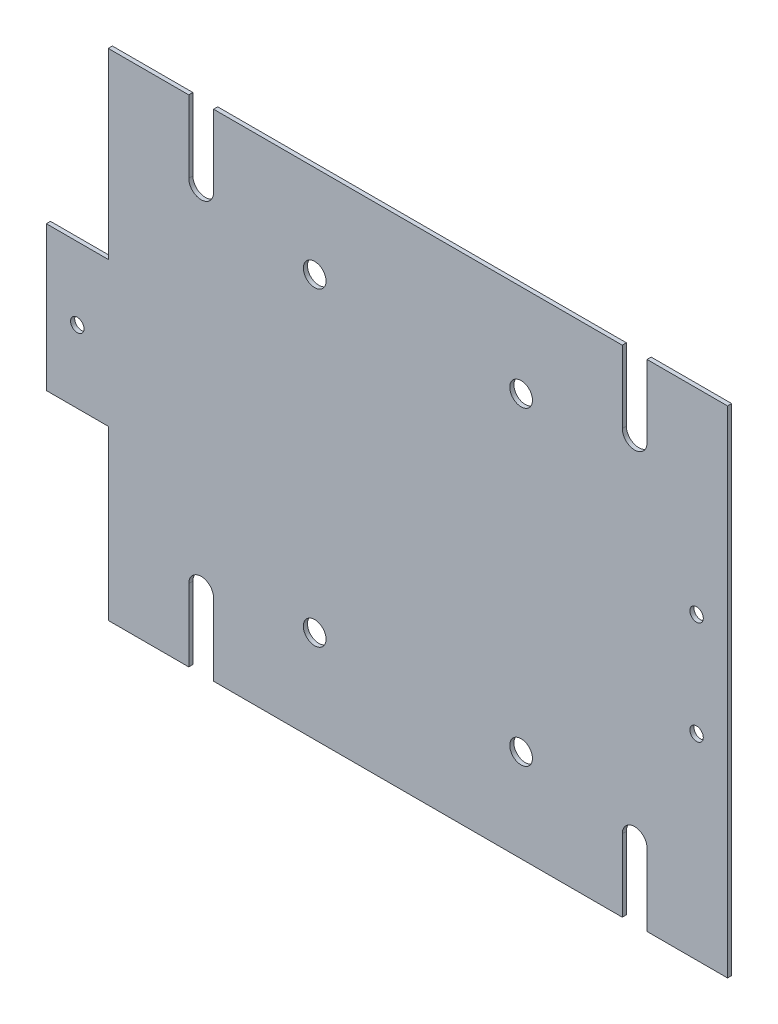
from build123d import *

# Parameters (mm, degrees)
SKETCH1_R           = 5.5
SKETCH1_R_2         = 3.25
BOSS_EXTRUDE1_DEPTH = 2


with BuildPart() as part:
    # Sketch1 → Boss-Extrude1 (new body)
    with BuildSketch(Plane.XY):
        with BuildLine():
            Line((68.948821818, 58.366235714), (29.948821818, 58.366235714))
            Line((29.948821818, 58.366235714), (29.948821818, 23.366235714))
            ThreePointArc((29.948821818, 23.366235714), (23.948821818, 17.366235714), (17.948821818, 23.366235714))
            Line((17.948821818, 23.366235714), (17.948821818, 58.366235714))
            Line((17.948821818, 58.366235714), (-180.051178182, 58.366235714))
            Line((-180.051178182, 58.366235714), (-180.051178182, 23.366235714))
            ThreePointArc((-180.051178182, 23.366235714), (-186.051178182, 17.366235714), (-192.051178182, 23.366235714))
            Line((-192.051178182, 23.366235714), (-192.051178182, 58.366235714))
            Line((-192.051178182, 58.366235714), (-231.051178182, 58.366235714))
            Line((-231.051178182, 58.366235714), (-231.051178182, -30.179856115))
            Line((-231.051178182, -30.179856115), (-261.051178182, -30.179856115))
            Line((-261.051178182, -30.179856115), (-261.051178182, -100.179856115))
            Line((-261.051178182, -100.179856115), (-231.051178182, -100.179856115))
            Line((-231.051178182, -100.179856115), (-231.051178182, -181.633764286))
            Line((-231.051178182, -181.633764286), (-192.051178182, -181.633764286))
            Line((-192.051178182, -181.633764286), (-192.051178182, -146.633764286))
            ThreePointArc((-192.051178182, -146.633764286), (-186.051178182, -140.633764286), (-180.051178182, -146.633764286))
            Line((-180.051178182, -146.633764286), (-180.051178182, -181.633764286))
            Line((-180.051178182, -181.633764286), (17.948821818, -181.633764286))
            Line((17.948821818, -181.633764286), (17.948821818, -146.633764286))
            ThreePointArc((17.948821818, -146.633764286), (23.948821818, -140.633764286), (29.948821818, -146.633764286))
            Line((29.948821818, -146.633764286), (29.948821818, -181.633764286))
            Line((29.948821818, -181.633764286), (68.948821818, -181.633764286))
            Line((68.948821818, -181.633764286), (68.948821818, -26.633764286))
            Line((68.948821818, -26.633764286), (68.948821818, 58.366235714))
        make_face()
        with Locations((-131.051178182, 13.486235714)):
            Circle(SKETCH1_R, mode=Mode.SUBTRACT)
        with Locations((53.948821818, -36.633764286)):
            Circle(SKETCH1_R_2, mode=Mode.SUBTRACT)
        with Locations((53.948821818, -86.633764286)):
            Circle(SKETCH1_R_2, mode=Mode.SUBTRACT)
        with Locations((-246.051178182, -65.179856115)):
            Circle(SKETCH1_R_2, mode=Mode.SUBTRACT)
        with Locations((-31.051178182, -136.753764286)):
            Circle(SKETCH1_R, mode=Mode.SUBTRACT)
        with Locations((-131.051178182, -136.753764286)):
            Circle(SKETCH1_R, mode=Mode.SUBTRACT)
        with Locations((-31.051178182, 13.486235714)):
            Circle(SKETCH1_R, mode=Mode.SUBTRACT)
    extrude(amount=BOSS_EXTRUDE1_DEPTH)


solid = part.part
